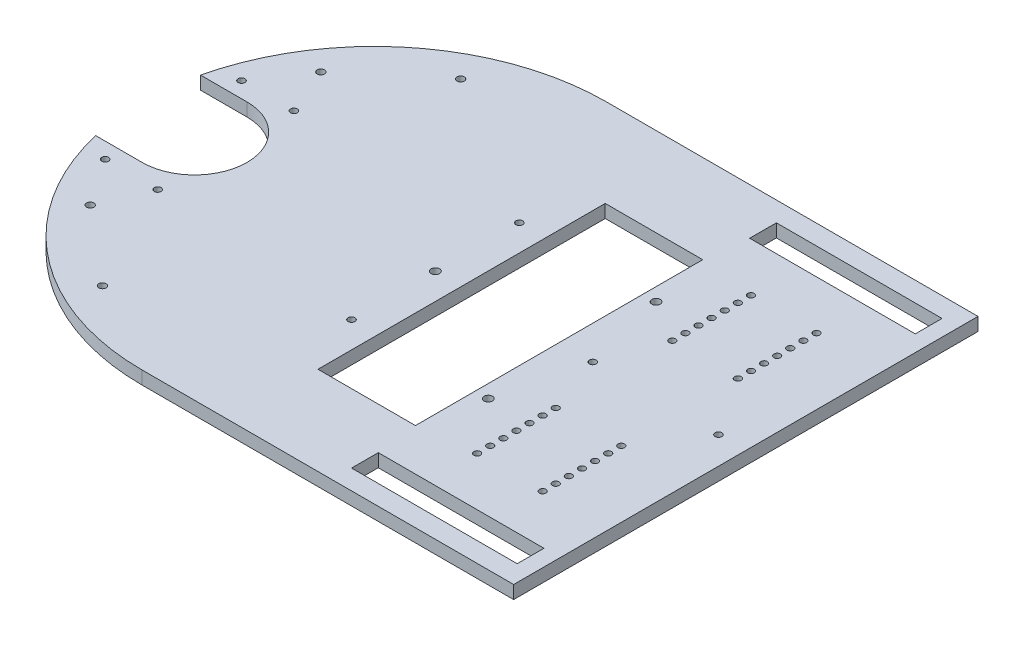
from build123d import *

# Parameters (mm, degrees)
BOSS_EXTRUDE1_DEPTH = 6.35
SKETCH2_R           = 1.5875
SKETCH2_W           = 80.264
SKETCH2_H           = 12.954
CUT_EXTRUDE1_DEPTH  = 224.053407282
SKETCH7_R           = 2.032
SKETCH7_R_2         = 1.651
SKETCH7_W           = 47.244
SKETCH7_H           = 139.192
CUT_EXTRUDE4_DEPTH  = 224.053407282
SKETCH8_R           = 1.651
CUT_EXTRUDE5_DEPTH  = 224.053407282
SKETCH9_R           = 1.778
CUT_EXTRUDE6_DEPTH  = 221.551312535


with BuildPart() as part:
    # Sketch1 → Boss-Extrude1 (new body)
    with BuildSketch(Plane(origin=(0, 0, 0), x_dir=(1, 0, 0), z_dir=(0, 1, 0))):
        with BuildLine():
            Line((-80, 112.5), (100, 112.5))
            Line((100, 112.5), (100, -112.5))
            Line((100, -112.5), (-80, -112.5))
            ThreePointArc((-80, -112.5), (-192.5, 0), (-80, 112.5))
        make_face()
    extrude(amount=-BOSS_EXTRUDE1_DEPTH)

    # Sketch2 → Cut-Extrude1 (cut, through all)
    with BuildSketch(Plane(origin=(0, 0, 0), x_dir=(1, 0, 0), z_dir=(0, 1, 0))):
        with Locations(Location((36.144045702, -66.3448, 0), (0, 0, 270))):
            Circle(SKETCH2_R)
        with Locations(Location((36.144045702, -59.9948, 0), (0, 0, 270))):
            Circle(SKETCH2_R)
        with Locations(Location((36.144045702, -53.6448, 0), (0, 0, 270))):
            Circle(SKETCH2_R)
        with Locations(Location((36.144045702, -47.2948, 0), (0, 0, 270))):
            Circle(SKETCH2_R)
        with Locations(Location((36.144045702, -40.9448, 0), (0, 0, 270))):
            Circle(SKETCH2_R)
        with Locations(Location((36.144045702, -34.5948, 0), (0, 0, 270))):
            Circle(SKETCH2_R)
        with Locations(Location((36.144045702, -28.2448, 0), (0, 0, 270))):
            Circle(SKETCH2_R)
        with Locations(Location((67.894045702, -66.3448, 0), (0, 0, 270))):
            Circle(SKETCH2_R)
        with Locations(Location((67.894045702, -59.9948, 0), (0, 0, 270))):
            Circle(SKETCH2_R)
        with Locations(Location((67.894045702, -53.6448, 0), (0, 0, 270))):
            Circle(SKETCH2_R)
        with Locations(Location((67.894045702, -47.2948, 0), (0, 0, 270))):
            Circle(SKETCH2_R)
        with Locations(Location((67.894045702, -40.9448, 0), (0, 0, 270))):
            Circle(SKETCH2_R)
        with Locations(Location((67.894045702, -34.5948, 0), (0, 0, 270))):
            Circle(SKETCH2_R)
        with Locations(Location((67.894045702, -28.2448, 0), (0, 0, 270))):
            Circle(SKETCH2_R)
        with Locations(Location((36.144045702, 66.3448, 0), (0, 0, 270))):
            Circle(SKETCH2_R)
        with Locations(Location((36.144045702, 59.9948, 0), (0, 0, 270))):
            Circle(SKETCH2_R)
        with Locations(Location((36.144045702, 53.6448, 0), (0, 0, 270))):
            Circle(SKETCH2_R)
        with Locations(Location((36.144045702, 47.2948, 0), (0, 0, 270))):
            Circle(SKETCH2_R)
        with Locations(Location((36.144045702, 40.9448, 0), (0, 0, 270))):
            Circle(SKETCH2_R)
        with Locations(Location((36.144045702, 34.5948, 0), (0, 0, 270))):
            Circle(SKETCH2_R)
        with Locations(Location((36.144045702, 28.2448, 0), (0, 0, 270))):
            Circle(SKETCH2_R)
        with Locations(Location((67.894045702, 66.3448, 0), (0, 0, 270))):
            Circle(SKETCH2_R)
        with Locations(Location((67.894045702, 59.9948, 0), (0, 0, 270))):
            Circle(SKETCH2_R)
        with Locations(Location((67.894045702, 53.6448, 0), (0, 0, 270))):
            Circle(SKETCH2_R)
        with Locations(Location((67.894045702, 47.2948, 0), (0, 0, 270))):
            Circle(SKETCH2_R)
        with Locations(Location((67.894045702, 40.9448, 0), (0, 0, 270))):
            Circle(SKETCH2_R)
        with Locations(Location((67.894045702, 34.5948, 0), (0, 0, 270))):
            Circle(SKETCH2_R)
        with Locations(Location((67.894045702, 28.2448, 0), (0, 0, 270))):
            Circle(SKETCH2_R)
        with Locations((52.019045702, -96.4438)):
            Rectangle(SKETCH2_W, SKETCH2_H)
        with Locations((52.019045702, 96.4438)):
            Rectangle(SKETCH2_W, SKETCH2_H)
    extrude(amount=-CUT_EXTRUDE1_DEPTH, mode=Mode.SUBTRACT)

    # Sketch7 → Cut-Extrude4 (cut, through all)
    with BuildSketch(Plane(origin=(0, 0, 0), x_dir=(1, 0, 0), z_dir=(0, 1, 0))):
        with Locations(Location((-50.421540267, 0, 0), (0, 0, 270))):
            Circle(SKETCH7_R)
        with Locations(Location((25.778459733, 0, 0), (0, 0, 270))):
            Circle(SKETCH7_R_2)
        with Locations(Location((86.738459733, 0, 0), (0, 0, 270))):
            Circle(SKETCH7_R_2)
        with Locations(Location((-50.421540267, 40.64, 0), (0, 0, 270))):
            Circle(SKETCH7_R_2)
        with Locations(Location((-50.421540267, -40.64, 0), (0, 0, 270))):
            Circle(SKETCH7_R_2)
        with Locations(Location((15.872459733, -40.64, 0), (0, 0, 270))):
            Circle(SKETCH7_R)
        with Locations(Location((15.872459733, 40.64, 0), (0, 0, 270))):
            Circle(SKETCH7_R)
        with Locations((-14.099540267, 0)):
            Rectangle(SKETCH7_W, SKETCH7_H)
    extrude(amount=-CUT_EXTRUDE4_DEPTH, mode=Mode.SUBTRACT)

    # Sketch8 → Cut-Extrude5 (cut, through all)
    with BuildSketch(Plane(origin=(0, 0, 0), x_dir=(1, 0, 0), z_dir=(0, 1, 0))):
        with Locations(Location((-177.3836, 33.02, 0), (0, 0, 270))):
            Circle(SKETCH8_R)
        with Locations(Location((-177.3836, -33.02, 0), (0, 0, 270))):
            Circle(SKETCH8_R)
        with Locations(Location((-151.9836, 33.02, 0), (0, 0, 270))):
            Circle(SKETCH8_R)
        with Locations(Location((-151.9836, -33.02, 0), (0, 0, 270))):
            Circle(SKETCH8_R)
        with BuildLine():
            Line((-167.0966, 25.4), (-229.776686608, 25.4))
            Line((-229.776686608, 25.4), (-229.776686608, -25.4))
            Line((-229.776686608, -25.4), (-167.0966, -25.4))
            ThreePointArc((-167.0966, -25.4), (-141.6966, 0), (-167.0966, 25.4))
        make_face()
    extrude(amount=-CUT_EXTRUDE5_DEPTH, mode=Mode.SUBTRACT)

    # Sketch9 → Cut-Extrude6 (cut, through all)
    with BuildSketch(Plane(origin=(0, 0, 0), x_dir=(1, 0, 0), z_dir=(0, 1, 0))):
        with Locations(Location((-161.795319669, -55.88, 0), (0, 0, 270))):
            Circle(SKETCH9_R)
        with Locations(Location((-124.964619687, -86.784626771, 0), (0, 0, 270))):
            Circle(SKETCH9_R)
        with Locations(Location((-161.795319669, 55.88, 0), (0, 0, 270))):
            Circle(SKETCH9_R)
        with Locations(Location((-124.964619687, 86.784626771, 0), (0, 0, 270))):
            Circle(SKETCH9_R)
    extrude(amount=-CUT_EXTRUDE6_DEPTH, mode=Mode.SUBTRACT)


solid = part.part
